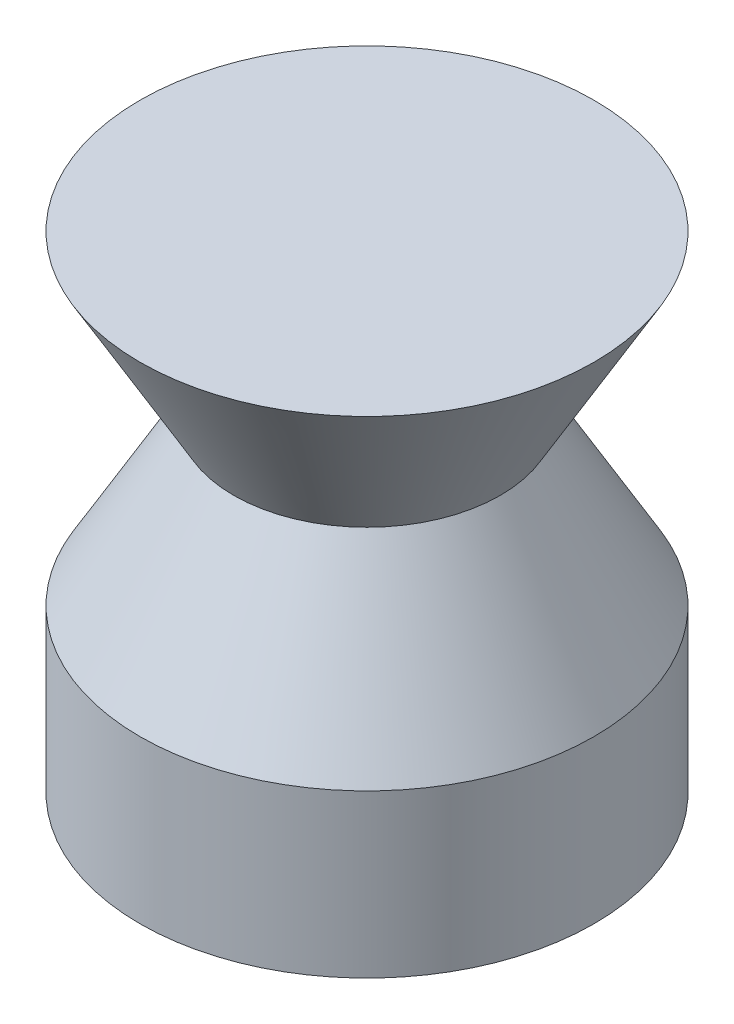
from build123d import *

# Parameters (mm, degrees)
SKETCH2_R           = 7
SKETCH2_W           = 3
SKETCH2_H           = 5
BOSS_EXTRUDE1_DEPTH = 5
SKETCH3_R           = 7
BOSS_EXTRUDE2_DEPTH = 5
BOSS_EXTRUDE2_TAPER = 30
SKETCH4_R           = 4.113248654
BOSS_EXTRUDE3_DEPTH = 5
BOSS_EXTRUDE3_DRAFT = -30


with BuildPart() as part:
    # Sketch2 → Boss-Extrude1 (new body)
    with BuildSketch(Plane(origin=(0, 0, 0), x_dir=(1, 0, 0), z_dir=(0, 1, 0))):
        with Locations(Location((-3.205882353, 1.576875202, 0), (0, 0, 270))):
            Circle(SKETCH2_R)
        with Locations((-3.205882353, 1.647058824)):
            Rectangle(SKETCH2_W, SKETCH2_H, mode=Mode.SUBTRACT)
    extrude(amount=BOSS_EXTRUDE1_DEPTH)

    # Sketch3 → Boss-Extrude2 (add)
    with BuildSketch(Plane(origin=(0, 5, 0), x_dir=(1, 0, 0), z_dir=(0, 1, 0))):
        with Locations(Location((-3.205882353, 1.576875202, 0), (0, 0, 270))):
            Circle(SKETCH3_R)
    extrude(amount=BOSS_EXTRUDE2_DEPTH, taper=BOSS_EXTRUDE2_TAPER)


with BuildPart() as boss_extrude3_tool:
    # Sketch4 → Boss-Extrude3 (with draft: the straight prism first)
    with BuildSketch(Plane(origin=(0, 10, 0), x_dir=(1, 0, 0), z_dir=(0, 1, 0))):
        with Locations((-3.205882353, 1.576875202)):
            Circle(SKETCH4_R)
    extrude(amount=BOSS_EXTRUDE3_DEPTH)
    # Boss-Extrude3: the draft: its side faces are tilted about the plane it starts from
    boss_extrude3_sides = [boss_extrude3_tool.faces().sort_by_distance(p)[0] for p in [
        (-7.319131007, 12.5, -1.576875202),
    ]]
    draft(boss_extrude3_sides, Plane(origin=(0, 10, 0), x_dir=(1, 0, 0), z_dir=(0, 1, 0)), BOSS_EXTRUDE3_DRAFT)


with BuildPart() as part_1:
    add(part.part)

    # Boss-Extrude3: add boss_extrude3_tool
    add(boss_extrude3_tool.part)


solid = part_1.part
